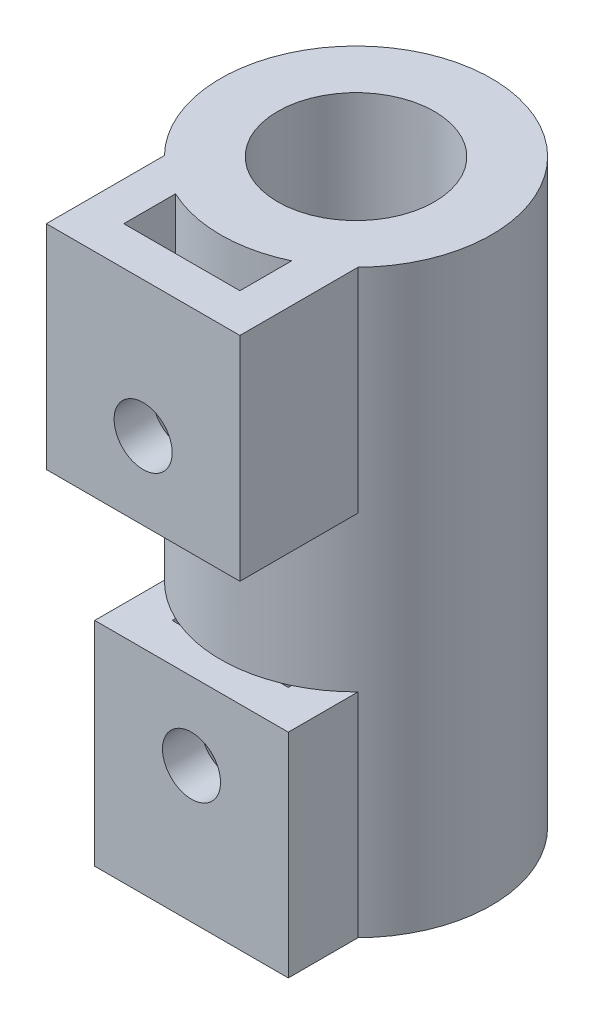
from build123d import *

# Parameters (mm, degrees)
SKETCH1_R               = 7
SKETCH1_R_2             = 4.05
BOSS_EXTRUDE1_DEPTH     = 15
BOSS_EXTRUDE2_START     = -15
SKETCH1_3_R             = 7
SKETCH1_3_R_2           = 1.7
BOSS_EXTRUDE2_DEPTH     = 15
CUT_EXTRUDE2_DEPTH      = 11
BOSS_EXTRUDE3_DEPTH     = 11
BOSS_EXTRUDE4_START     = -11
SKETCH4_W               = 10
SKETCH4_H               = 6.101020514
BOSS_EXTRUDE4_DEPTH     = 11
CUT_EXTRUDE1_DEPTH      = 20.874606914
CUT_EXTRUDE1_DEPTH_BACK = 20.874606914
SKETCH2_R               = 1.5


with BuildPart() as part:
    # Sketch1 → Boss-Extrude1 (new body)
    with BuildSketch(Plane(origin=(0, 0, 0), x_dir=(1, 0, 0), z_dir=(0, 1, 0))):
        Circle(SKETCH1_R)
        Circle(SKETCH1_R_2, mode=Mode.SUBTRACT)
    extrude(amount=BOSS_EXTRUDE1_DEPTH)

    # Sketch1<3> → Boss-Extrude2 (add)
    with BuildSketch(Plane(origin=(0, 0, 0), x_dir=(1, 0, 0), z_dir=(0, 1, 0)).offset(BOSS_EXTRUDE2_START)):
        Circle(SKETCH1_3_R)
        Circle(SKETCH1_3_R_2, mode=Mode.SUBTRACT)
    extrude(amount=BOSS_EXTRUDE2_DEPTH)

    # Sketch3 → Cut-Extrude2 (cut)
    with BuildSketch(Plane.XZ.offset(15)):
        with BuildLine():
            Line((2.598076211, 6.5), (-2.598076211, 6.5))
            ThreePointArc((-2.598076211, 6.5), (-2.800412385, 6.415425978), (-3, 6.32455532))
            Line((-3, 6.32455532), (-3, 3.5))
            Line((-3, 3.5), (3, 3.5))
            Line((3, 3.5), (3, 6.32455532))
            ThreePointArc((3, 6.32455532), (2.800412385, 6.415425978), (2.598076211, 6.5))
        make_face()
    extrude(amount=-CUT_EXTRUDE2_DEPTH, mode=Mode.SUBTRACT)

    # Sketch3<3> → Boss-Extrude3 (add)
    with BuildSketch(Plane.XZ.offset(15)):
        with BuildLine():
            Line((-3, 6.32455532), (-3, 6.5))
            Line((-3, 6.5), (-2.598076211, 6.5))
            ThreePointArc((-2.598076211, 6.5), (0, 7), (2.598076211, 6.5))
            Line((2.598076211, 6.5), (3, 6.5))
            Line((3, 6.5), (3, 6.32455532))
            ThreePointArc((3, 6.32455532), (4.063012013, 5.700169593), (5, 4.898979486))
            Line((5, 4.898979486), (5, 8.5))
            Line((5, 8.5), (-5, 8.5))
            Line((-5, 8.5), (-5, 4.898979486))
            ThreePointArc((-5, 4.898979486), (-4.063012013, 5.700169593), (-3, 6.32455532))
        make_face()
    extrude(amount=-BOSS_EXTRUDE3_DEPTH)

    # Sketch4 → Boss-Extrude4 (add)
    with BuildSketch(Plane(origin=(0, 15, 0), x_dir=(1, 0, 0), z_dir=(0, 1, 0)).offset(BOSS_EXTRUDE4_START)):
        with Locations((0, -7.949489743)):
            Rectangle(SKETCH4_W, SKETCH4_H)
        with BuildLine():
            Line((-3.605551275, -6), (3.605551275, -6))
            ThreePointArc((3.605551275, -6), (3.306759887, -6.169711423), (3, -6.32455532))
            Line((3, -6.32455532), (3, -9))
            Line((3, -9), (-3, -9))
            Line((-3, -9), (-3, -6.32455532))
            ThreePointArc((-3, -6.32455532), (-3.306759887, -6.169711423), (-3.605551275, -6))
        make_face(mode=Mode.SUBTRACT)
    extrude(amount=BOSS_EXTRUDE4_DEPTH)

    # Sketch2 → Cut-Extrude1 (cut, two sides: drawn at the far end of the back side and taken through both)
    with BuildSketch(Plane.XY.offset(-CUT_EXTRUDE1_DEPTH_BACK)):
        with Locations((0, 8)):
            Circle(SKETCH2_R)
        with Locations((0, -8)):
            Circle(SKETCH2_R)
    extrude(amount=CUT_EXTRUDE1_DEPTH + CUT_EXTRUDE1_DEPTH_BACK, mode=Mode.SUBTRACT)


solid = part.part
